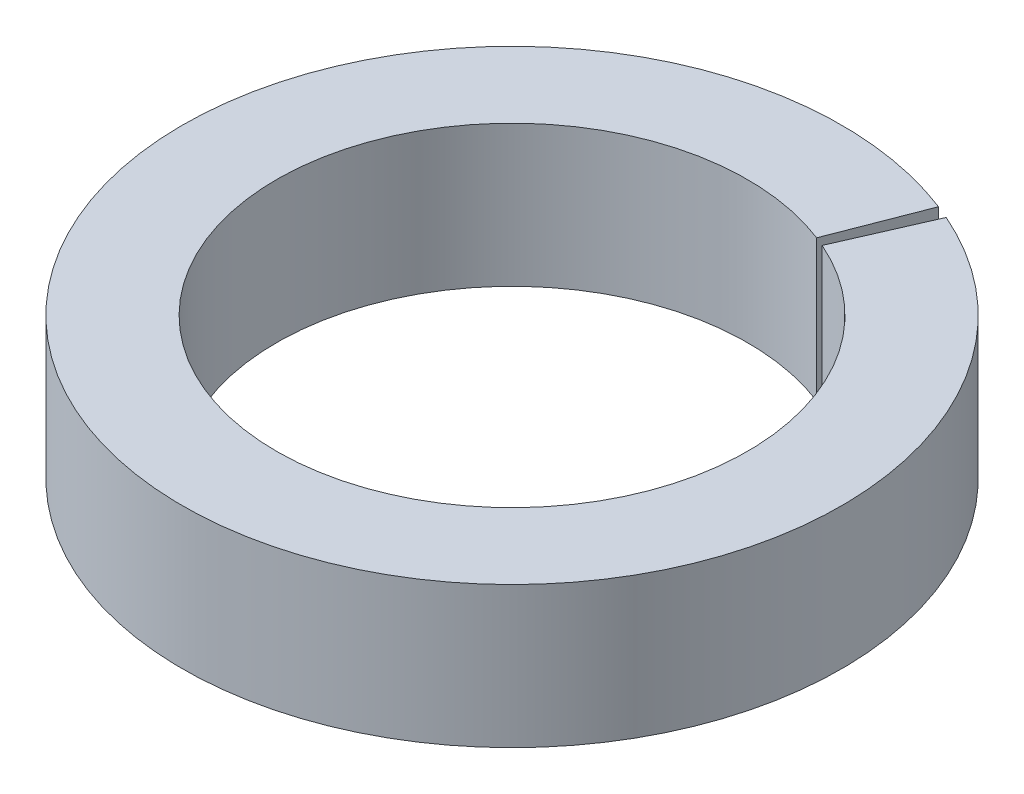
from build123d import *

# Parameters (mm, degrees)
BOSS_EXTRUDE1_DEPTH = 19.05


with BuildPart() as part:
    # Sketch1 → Boss-Extrude1 (new body)
    with BuildSketch(Plane(origin=(0, 0, 0), x_dir=(1, 0, 0), z_dir=(0, 1, 0))):
        with BuildLine():
            Line((16.062876659, 41.446187924), (11.473483328, 29.604419946))
            ThreePointArc((11.473483328, 29.604419946), (-12.108442283, -29.350436547), (12.737783647, 29.082836309))
            Line((12.737783647, 29.082836309), (17.832897106, 40.715970832))
            ThreePointArc((17.832897106, 40.715970832), (-16.951819196, -41.090611166), (16.062876659, 41.446187924))
        make_face()
    extrude(amount=BOSS_EXTRUDE1_DEPTH)


solid = part.part
